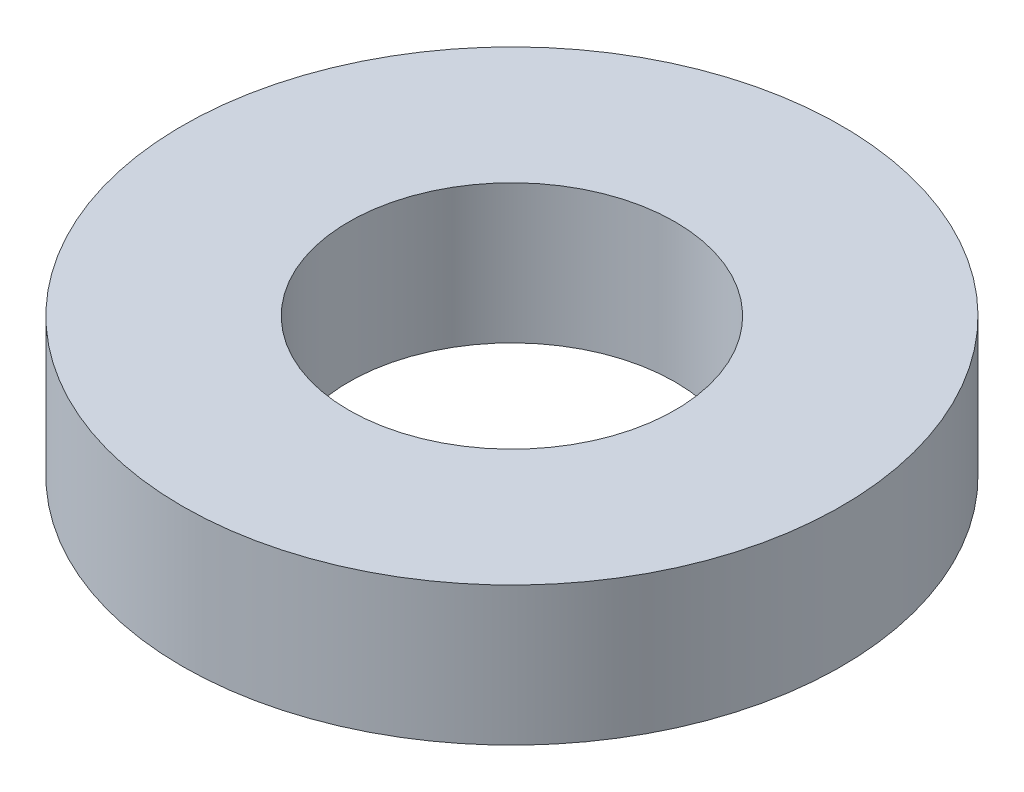
from build123d import *

# Parameters (mm, degrees)
SKETCH_1_R      = 40.4
SKETCH_1_R_2    = 20
EXTRUDE_1_DEPTH = 17


with BuildPart() as part:
    # 草图1 → 凸台-拉伸1 (new body)
    with BuildSketch(Plane(origin=(0, 0, 0), x_dir=(1, 0, 0), z_dir=(0, 1, 0))):
        with Locations(Location((0, 0, 0), (0, 0, 270))):
            Circle(SKETCH_1_R)
        with Locations(Location((0, 0, 0), (0, 0, 270))):
            Circle(SKETCH_1_R_2, mode=Mode.SUBTRACT)
    extrude(amount=EXTRUDE_1_DEPTH)


solid = part.part
